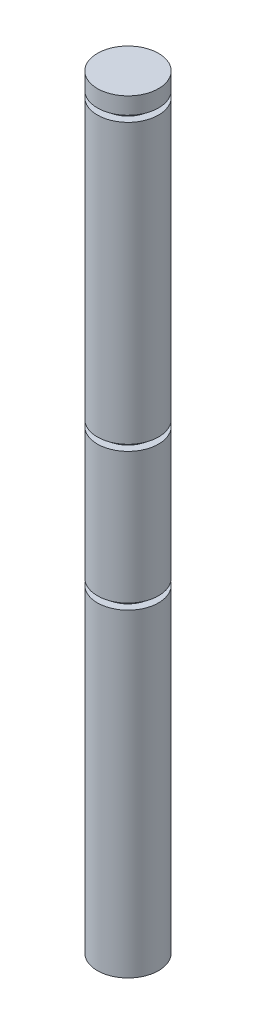
from build123d import *

# Parameters (mm, degrees)
SKETCH1_R           = 4
BOSS_EXTRUDE1_DEPTH = 100
SKETCH2_W           = 1
SKETCH2_H           = 0.8
SKETCH3_W           = 1
SKETCH3_H           = 0.8
LPATTERN1_COUNT     = 2
LPATTERN1_PITCH     = 18


with BuildPart() as part:
    # Sketch1 → Boss-Extrude1 (new body)
    with BuildSketch(Plane(origin=(0, 0, 0), x_dir=(1, 0, 0), z_dir=(0, 1, 0))):
        with Locations(Location((0, 0, 0), (0, 0, 270))):
            Circle(SKETCH1_R)
    extrude(amount=BOSS_EXTRUDE1_DEPTH)

    # Sketch2 → Cut-Revolve1 (revolve, cut)
    with BuildSketch(Plane(origin=(0, 0, 0), x_dir=(0, 0, -1), z_dir=(1, 0, 0)), mode=Mode.PRIVATE) as cut_revolve1_sk:
        with Locations((3.5, 97.4)):
            Rectangle(SKETCH2_W, SKETCH2_H)
    revolve(cut_revolve1_sk.sketch.rotate(Axis((0, 100, 0), (0, -1, 0)), 180), axis=Axis((0, 100, 0), (0, -1, 0)), mode=Mode.SUBTRACT)

    # Sketch3 → Cut-Revolve2 (revolve, cut)
    with BuildSketch(Plane(origin=(0, 0, 0), x_dir=(0, 0, -1), z_dir=(1, 0, 0)), mode=Mode.PRIVATE) as cut_revolve2_sk:
        with Locations((3.5, 60.1)):
            Rectangle(SKETCH3_W, SKETCH3_H)
    cut_revolve2 = revolve(cut_revolve2_sk.sketch.rotate(Axis((0, 100, 0), (0, -1, 0)), 180), axis=Axis((0, 100, 0), (0, -1, 0)), mode=Mode.SUBTRACT)

    # LPattern1: Cut-Revolve2 ×2
    with Locations(*[(0, -i * LPATTERN1_PITCH, 0) for i in range(1, LPATTERN1_COUNT)]):
        add(cut_revolve2, mode=Mode.SUBTRACT)


solid = part.part
